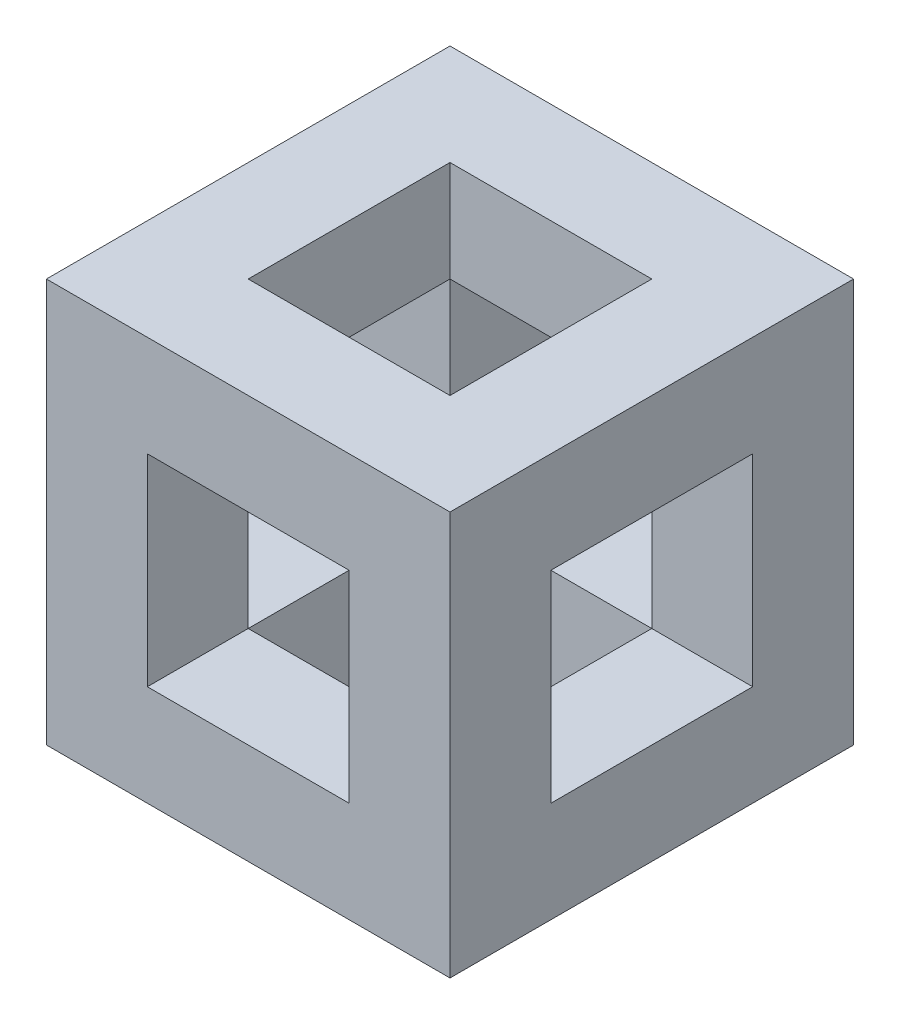
from build123d import *

# Parameters (mm, degrees)
SKETCH2_W           = 50
SKETCH2_H           = 50
BOSS_EXTRUDE1_DEPTH = 50
SKETCH3_W           = 25
SKETCH3_H           = 25
CUT_EXTRUDE1_DEPTH  = 76
SKETCH4_W           = 25
SKETCH4_H           = 25
CUT_EXTRUDE2_DEPTH  = 62.23724357
SKETCH5_W           = 25
SKETCH5_H           = 25
CUT_EXTRUDE3_DEPTH  = 76


with BuildPart() as part:
    # Sketch2 → Boss-Extrude1 (new body)
    with BuildSketch(Plane.XY):
        Rectangle(SKETCH2_W, SKETCH2_H)
    extrude(amount=BOSS_EXTRUDE1_DEPTH)

    # Sketch3 → Cut-Extrude1 (cut, through all)
    with BuildSketch(Plane(origin=(0, 25, 0), x_dir=(1, 0, 0), z_dir=(0, 1, 0))):
        with Locations((0, -25)):
            Rectangle(SKETCH3_W, SKETCH3_H)
    extrude(amount=-CUT_EXTRUDE1_DEPTH, mode=Mode.SUBTRACT)

    # Sketch4 → Cut-Extrude2 (cut, through all)
    with BuildSketch(Plane.XY.offset(50)):
        Rectangle(SKETCH4_W, SKETCH4_H)
    extrude(amount=-CUT_EXTRUDE2_DEPTH, mode=Mode.SUBTRACT)

    # Sketch5 → Cut-Extrude3 (cut, through all)
    with BuildSketch(Plane(origin=(25, 0, 0), x_dir=(0, 0, -1), z_dir=(1, 0, 0))):
        with Locations((-25, 0)):
            Rectangle(SKETCH5_W, SKETCH5_H)
    extrude(amount=-CUT_EXTRUDE3_DEPTH, mode=Mode.SUBTRACT)


solid = part.part
